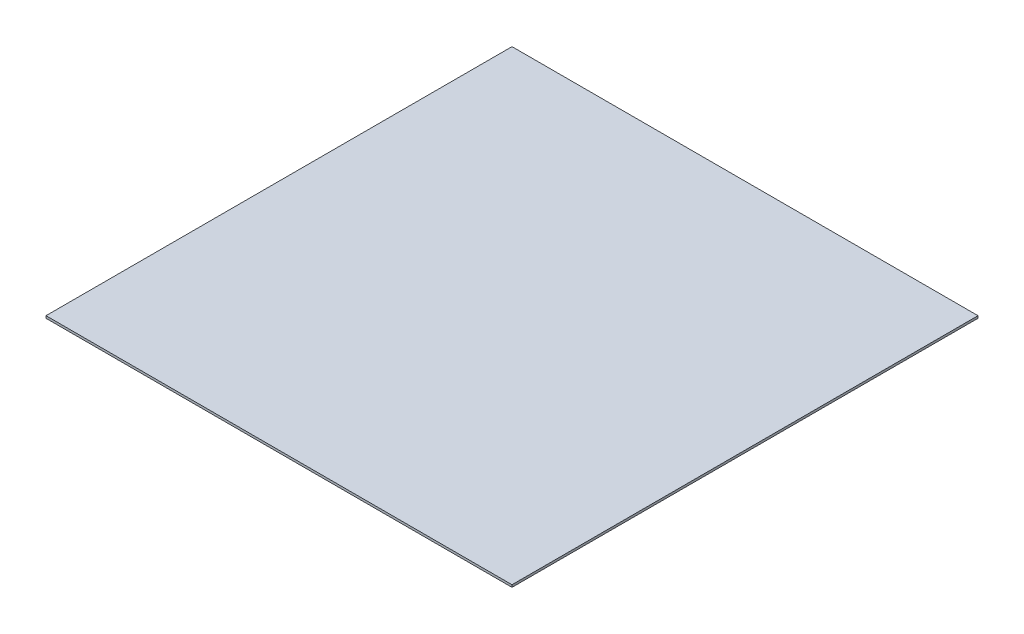
from build123d import *

# Parameters (mm, degrees)
SKETCH1_W           = 304
SKETCH1_H           = 304
BOSS_EXTRUDE1_DEPTH = 1.5


with BuildPart() as part:
    # Sketch1 → Boss-Extrude1 (new body)
    with BuildSketch(Plane(origin=(0, 0, 0), x_dir=(1, 0, 0), z_dir=(0, 1, 0))):
        Rectangle(SKETCH1_W, SKETCH1_H)
    extrude(amount=BOSS_EXTRUDE1_DEPTH)


solid = part.part
